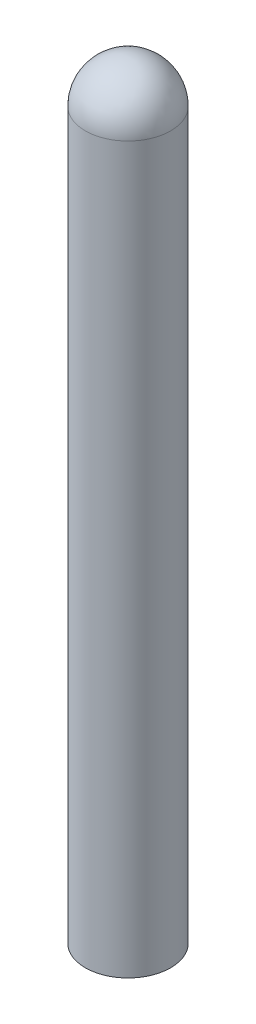
from build123d import *

# Parameters (mm, degrees)
SKETCH2_R           = 3.175
BOSS_EXTRUDE1_DEPTH = 57.15
FILLET1_R           = 3.175


with BuildPart() as part:
    # Sketch2 → Boss-Extrude1 (new body)
    with BuildSketch(Plane(origin=(0, 0, 0), x_dir=(1, 0, 0), z_dir=(0, 1, 0))):
        with Locations(Location((0, 0, 0), (0, 0, 270))):
            Circle(SKETCH2_R)
    extrude(amount=BOSS_EXTRUDE1_DEPTH)

    # Fillet1
    fillet1_edges = [part.edges().sort_by_distance(p)[0] for p in [
        (0, 57.15, -3.175),
    ]]
    fillet(fillet1_edges, radius=FILLET1_R)


solid = part.part
